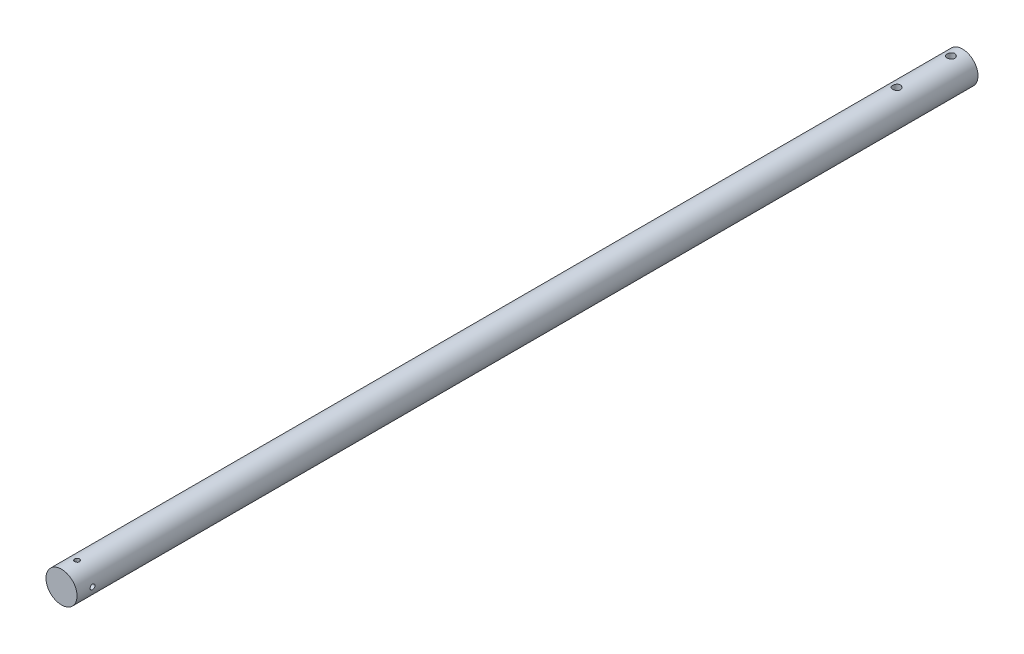
from build123d import *
from build123d.topology import SkipClean

# Parameters (mm, degrees)
SKETCH2_W           = 25.4
SKETCH2_H           = 25.4
BOSS_EXTRUDE1_DEPTH = 736.6
SKETCH4_R           = 3.175
SKETCH4_R_2         = 1.984375
CUT_EXTRUDE1_DEPTH  = 736.6
SKETCH5_R           = 1.984375
CUT_EXTRUDE2_DEPTH  = 736.6
CUT_EXTRUDE3_DEPTH  = 736.6


with BuildPart() as part:
    # Sketch2 → Boss-Extrude1 (new body)
    with BuildSketch(Plane.XY):
        with Locations((12.7, 12.7)):
            Rectangle(SKETCH2_W, SKETCH2_H)
    extrude(amount=BOSS_EXTRUDE1_DEPTH)

    # Sketch4 → Cut-Extrude1 (cut)
    with BuildSketch(Plane(origin=(0, 25.4, 0), x_dir=(1, 0, 0), z_dir=(0, 1, 0))):
        with Locations(Location((12.7, -9.525, 0), (0, 0, 270))):
            Circle(SKETCH4_R)
        with Locations(Location((12.7, -53.975, 0), (0, 0, 270))):
            Circle(SKETCH4_R)
        with Locations(Location((12.7, -723.9, 0), (0, 0, 270))):
            Circle(SKETCH4_R_2)
    extrude(amount=-CUT_EXTRUDE1_DEPTH, mode=Mode.SUBTRACT)

    # Sketch5 → Cut-Extrude2 (cut)
    with BuildSketch(Plane(origin=(25.4, 0, 0), x_dir=(0, 0, -1), z_dir=(1, 0, 0))):
        with Locations((-723.9, 12.7)):
            Circle(SKETCH5_R)
    extrude(amount=-CUT_EXTRUDE2_DEPTH, mode=Mode.SUBTRACT)

    # Sketch6 → Cut-Extrude3 (cut)
    with SkipClean():  # the faces are left unmerged after this step: merging them gives an invalid solid
        with BuildSketch(Plane.XY.offset(736.6)):
            with BuildLine():
                Line((0, 25.4), (0, 12.7))
                ThreePointArc((0, 12.7), (3.719743879, 21.680256121), (12.7, 25.4))
                Line((12.7, 25.4), (0, 25.4))
            make_face()
            with BuildLine():
                ThreePointArc((12.7, 25.4), (21.680256121, 21.680256121), (25.4, 12.7))
                Line((25.4, 12.7), (25.4, 25.4))
                Line((25.4, 25.4), (12.7, 25.4))
            make_face()
            with BuildLine():
                Line((25.4, 0), (25.4, 12.7))
                ThreePointArc((25.4, 12.7), (21.680256121, 3.719743879), (12.7, 0))
                Line((12.7, 0), (25.4, 0))
            make_face()
            with BuildLine():
                ThreePointArc((12.7, 0), (3.719743879, 3.719743879), (0, 12.7))
                Line((0, 12.7), (0, 0))
                Line((0, 0), (12.7, 0))
            make_face()
        extrude(amount=-CUT_EXTRUDE3_DEPTH, mode=Mode.SUBTRACT)


solid = part.part
